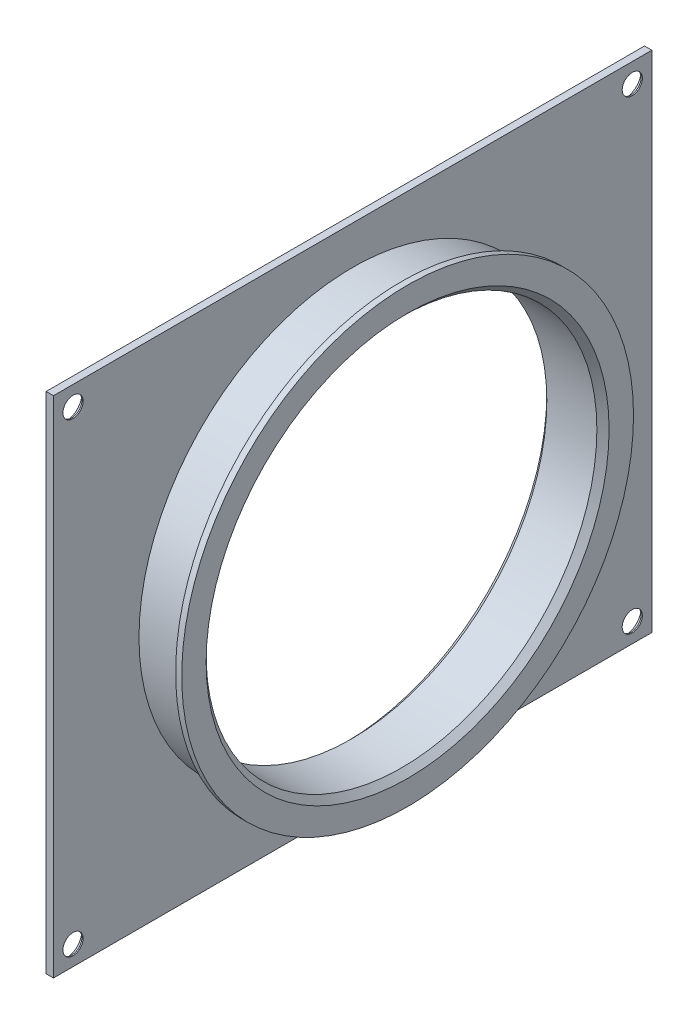
from build123d import *

# Parameters (mm, degrees)
SKETCH1_W           = 82.6
SKETCH1_H           = 98
BOSS_EXTRUDE1_DEPTH = 1.2
SKETCH2_R           = 1.65
CUT_EXTRUDE1_DEPTH  = 129.172539961
SKETCH3_R           = 35
BOSS_EXTRUDE2_DEPTH = 8
SKETCH4_R           = 37
BOSS_EXTRUDE3_DEPTH = 1
SKETCH5_R           = 32
CUT_EXTRUDE2_DEPTH  = 129.572158728
CHAMFER1_SIZE       = 1


with BuildPart() as part:
    # Sketch1 → Boss-Extrude1 (new body)
    with BuildSketch(Plane.YZ):
        with Locations((41.3, 49)):
            Rectangle(SKETCH1_W, SKETCH1_H)
    extrude(amount=BOSS_EXTRUDE1_DEPTH)

    # Sketch2 → Cut-Extrude1 (cut, through all)
    with BuildSketch(Plane.YZ.offset(1.2)):
        with Locations(Location((3.2, 94.8, 0), (0, 0, 270))):
            Circle(SKETCH2_R)
        with Locations(Location((79.4, 94.8, 0), (0, 0, 270))):
            Circle(SKETCH2_R)
        with Locations(Location((3.2, 3.2, 0), (0, 0, 270))):
            Circle(SKETCH2_R)
        with Locations(Location((79.4, 3.2, 0), (0, 0, 270))):
            Circle(SKETCH2_R)
    extrude(amount=-CUT_EXTRUDE1_DEPTH, mode=Mode.SUBTRACT)

    # Sketch3 → Boss-Extrude2 (add)
    with BuildSketch(Plane.YZ.offset(1.2)):
        with Locations(Location((41.3, 49, 0), (0, 0, 270))):
            Circle(SKETCH3_R)
    extrude(amount=BOSS_EXTRUDE2_DEPTH)

    # Sketch4 → Boss-Extrude3 (add)
    with BuildSketch(Plane.YZ.offset(9.2)):
        with Locations(Location((41.3, 49, 0), (0, 0, 270))):
            Circle(SKETCH4_R)
    extrude(amount=BOSS_EXTRUDE3_DEPTH)

    # Sketch5 → Cut-Extrude2 (cut, through all)
    with BuildSketch(Plane.YZ.offset(10.2)):
        with Locations(Location((41.3, 49, 0), (0, 0, 270))):
            Circle(SKETCH5_R)
    extrude(amount=-CUT_EXTRUDE2_DEPTH, mode=Mode.SUBTRACT)

    # Chamfer1
    chamfer1_edges = [part.edges().sort_by_distance(p)[0] for p in [
        (0, 79.4, 96.45),
        (0, 3.2, 4.85),
        (0, 79.4, 4.85),
        (0, 3.2, 96.45),
        (0, 41.3, 81),
        (10.2, 41.3, 81),
    ]]
    chamfer(chamfer1_edges, length=CHAMFER1_SIZE)


solid = part.part
